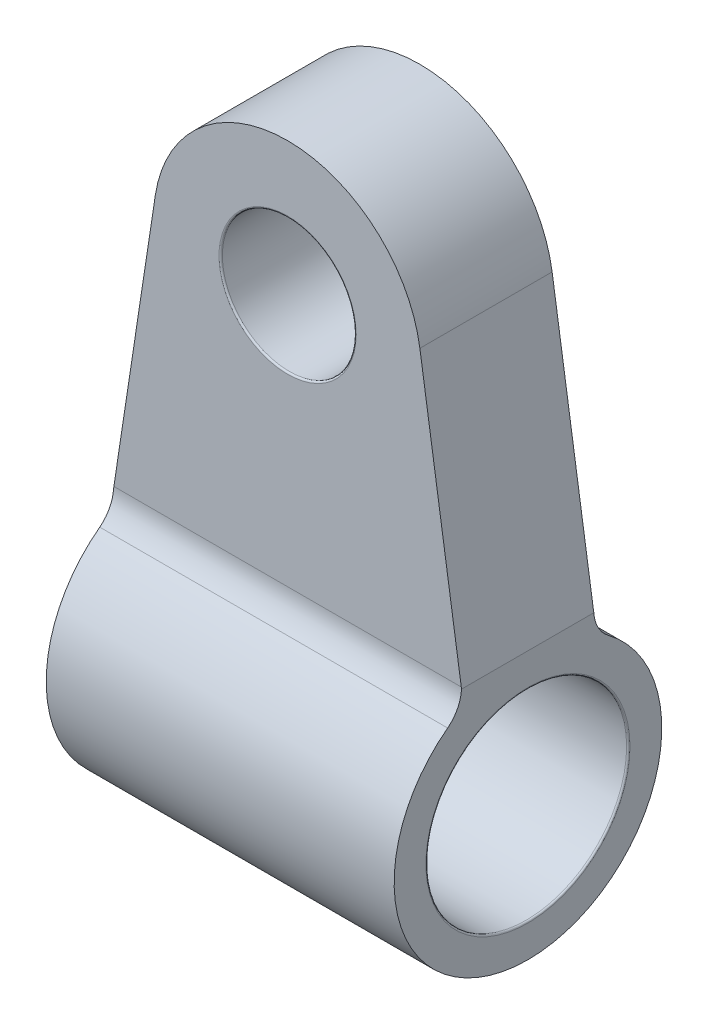
from build123d import *

# Parameters (mm, degrees)
SKETCH1_R           = 20
BOSS_EXTRUDE1_DEPTH = 26
BOSS_EXTRUDE2_START = -52
BOSS_EXTRUDE2_DEPTH = 52
CUT_EXTRUDE2_DEPTH  = 26
SKETCH7_R           = 10
CUT_EXTRUDE3_DEPTH  = 52
SKETCH8_R           = 15
CUT_EXTRUDE4_DEPTH  = 52
FILLET1_R           = 0.25


with BuildPart() as part:
    # Sketch1 → Boss-Extrude1 (new, symmetric)
    with BuildSketch(Plane(origin=(0, 0, 0), x_dir=(0, 0, -1), z_dir=(1, 0, 0))):
        with Locations(Location((0, 0, 0), (0, 0, 180))):
            Circle(SKETCH1_R)
    extrude(amount=BOSS_EXTRUDE1_DEPTH, both=True)

    # Sketch4 → Boss-Extrude2 (add)
    with BuildSketch(Plane.ZY.offset(26).offset(BOSS_EXTRUDE2_START)):
        with BuildLine():
            Line((-9.839336332, 20.254001388), (-9.839336332, 78))
            Line((-9.839336332, 78), (9.927883161, 78))
            Line((9.927883161, 78), (9.927883161, 20.254001388))
            ThreePointArc((9.927883161, 20.254001388), (10.473458868, 17.8880874), (12, 16))
            ThreePointArc((12, 16), (0, 20), (-12, 16))
            ThreePointArc((-12, 16), (-10.424631432, 17.875564978), (-9.839336332, 20.254001388))
        make_face()
    extrude(amount=BOSS_EXTRUDE2_DEPTH)

    # Sketch3 → Cut-Extrude2 (cut, symmetric)
    with BuildSketch(Plane.XY):
        with BuildLine():
            Line((-26, 20), (-19.773297574, 61.002782551))
            ThreePointArc((-19.773297574, 61.002782551), (-13.037337707, 73.16666824), (0, 78))
            Line((0, 78), (-26, 78))
            Line((-26, 78), (-26, 20))
        make_face()
    cut_extrude2 = extrude(amount=CUT_EXTRUDE2_DEPTH, both=True, mode=Mode.SUBTRACT)

    # Mirror1: Cut-Extrude2 across plane
    add(cut_extrude2.mirror(Plane(origin=(0, 0, 0), x_dir=(0, 0, 1), z_dir=(1, 0, 0))), mode=Mode.SUBTRACT)

    # Sketch7 → Cut-Extrude3 (cut)
    with BuildSketch(Plane.XY.offset(9.927883161)):
        with Locations((0, 58)):
            Circle(SKETCH7_R)
    extrude(amount=-CUT_EXTRUDE3_DEPTH, mode=Mode.SUBTRACT)

    # Sketch8 → Cut-Extrude4 (cut)
    with BuildSketch(Plane(origin=(26, 0, 0), x_dir=(0, 0, -1), z_dir=(1, 0, 0))):
        Circle(SKETCH8_R)
    extrude(amount=-CUT_EXTRUDE4_DEPTH, mode=Mode.SUBTRACT)

    # Fillet1
    fillet1_edges = [part.edges().sort_by_distance(p)[0] for p in [
        (-10, 58, -9.839336332),
        (-10, 58, 9.927883161),
        (-26, 0, 15),
        (26, 0, 15),
    ]]
    fillet(fillet1_edges, radius=FILLET1_R)


solid = part.part
